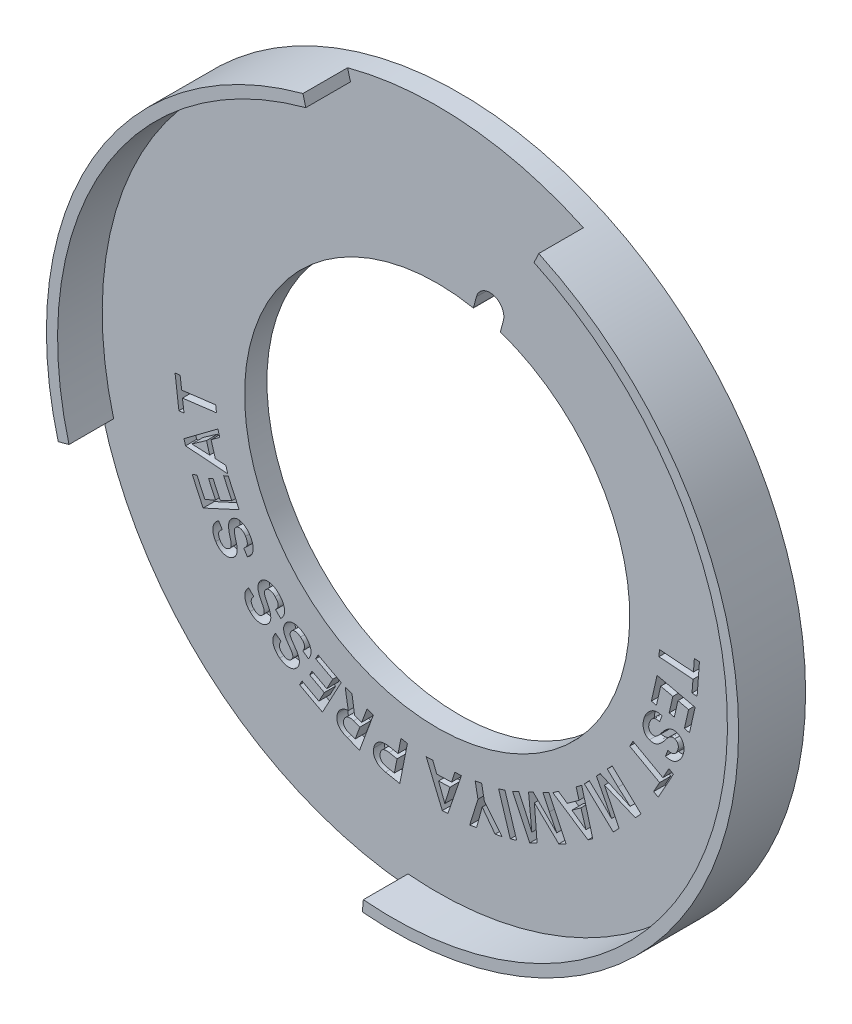
from build123d import *

# Parameters (mm, degrees)
SKETCH_1_R          = 31
SKETCH_1_R_2        = 17.25
EXTRUDE_1_DEPTH     = 2
SKETCH_2_R          = 31
SKETCH_2_R_2        = 30
EXTRUDE_2_DEPTH     = 4
CUT_EXTRUDE_1_DEPTH = 4
SKETCH_4_R          = 30
CUT_EXTRUDE_2_DEPTH = 45.022721406
CUT_EXTRUDE_3_DEPTH = 1


with BuildPart() as part:
    # 草图1 → 凸台-拉伸1 (new body)
    with BuildSketch(Plane.XY):
        Circle(SKETCH_1_R)
        Circle(SKETCH_1_R_2, mode=Mode.SUBTRACT)
    extrude(amount=EXTRUDE_1_DEPTH)

    # 草图2 → 凸台-拉伸2 (add)
    with BuildSketch(Plane.XY.offset(2)):
        Circle(SKETCH_2_R)
        Circle(SKETCH_2_R_2, mode=Mode.SUBTRACT)
    extrude(amount=EXTRUDE_2_DEPTH)

    # 草图3 → 切除-拉伸1 (cut)
    with BuildSketch(Plane.XY.offset(2)):
        with BuildLine():
            Line((3.257221245, 16.98574431), (3.51604029, 17.951670136))
            ThreePointArc((3.51604029, 17.951670136), (5.046971379, 18.835553613), (5.930854856, 17.304622523))
            Line((5.930854856, 17.304622523), (5.672035811, 16.338696697))
            ThreePointArc((5.672035811, 16.338696697), (4.141104722, 15.454813221), (3.257221245, 16.98574431))
        make_face()
    extrude(amount=-CUT_EXTRUDE_1_DEPTH, mode=Mode.SUBTRACT)

    # 草图4 → 切除-拉伸2 (cut, through all)
    with BuildSketch(Plane.XY.offset(2)):
        with BuildLine():
            Line((-8.023390398, -29.943700615), (-7.764571353, -28.977774789))
            ThreePointArc((-7.764571353, -28.977774789), (-21.213203436, -21.213203436), (-28.977774789, -7.764571353))
            Line((-28.977774789, -7.764571353), (-29.943700615, -8.023390398))
            ThreePointArc((-29.943700615, -8.023390398), (-21.920310217, -21.920310217), (-8.023390398, -29.943700615))
        make_face()
        Circle(SKETCH_4_R)
        with BuildLine():
            Line((0, 0), (13.101166114, 28.095541398))
            ThreePointArc((13.101166114, 28.095541398), (2.701828025, 30.882035641), (-8.023390398, 29.943700615))
            Line((-8.023390398, 29.943700615), (0, 0))
        make_face()
        with BuildLine():
            ThreePointArc((-2.614672282, -29.885840943), (-5.20944533, -29.54423259), (-7.764571353, -28.977774789))
            Line((-7.764571353, -28.977774789), (-8.023390398, -29.943700615))
            ThreePointArc((-8.023390398, -29.943700615), (-5.383093508, -30.529040343), (-2.701828025, -30.882035641))
            Line((-2.701828025, -30.882035641), (-2.614672282, -29.885840943))
        make_face()
    extrude(amount=CUT_EXTRUDE_2_DEPTH, mode=Mode.SUBTRACT)

    # 草图5 → 切除-拉伸3 (cut)
    # profile 1 of 19: a face of its own
    with BuildSketch(Plane.XY.offset(2)):
        Polygon((22.828125, -3.128551136), (22.910511364, -2.027698864), (19.865056818, -1.799715909), (19.909090909, -1.213778409), (22.954545455, -1.441761364), (23.036931818, -0.343039773), (23.491477273, -0.377130682), (23.282670455, -3.162642045), align=None)
    # profile 2 of 19: a face of its own
    with BuildSketch(Plane.XY.offset(2)):
        Polygon((20.78451682, -5.695862929), (21.110511138, -4.253391338), (20.019602047, -4.006942475), (19.641050911, -5.682368611), (19.186505456, -5.579385657), (19.695028183, -3.328675429), (23.104119093, -4.09927202), (22.600567956, -6.327254975), (22.146022502, -6.22427202), (22.519602047, -4.571573157), (21.565056593, -4.356374293), (21.239062274, -5.798845884), align=None)
    # profile 3 of 19: a face of its own
    with BuildSketch(Plane.XY.offset(2)):
        with BuildLine():
            add(Edge.make_bspline(
                [(20.093645724, -7.59594016), (20.12433098, -7.555905091), (20.184044574, -7.477996736), (20.276399819, -7.368917371), (20.367088186, -7.269552334), (20.457559468, -7.181788563), (20.545663399, -7.10261671), (20.633541505, -7.034589094), (20.720221315, -6.976528805), (20.806331779, -6.92921631), (20.891845452, -6.890826889), (20.978171748, -6.863305939), (21.064911166, -6.84413789), (21.152394989, -6.836014099), (21.240524134, -6.836358566), (21.328979327, -6.847617329), (21.418445682, -6.867049498), (21.476656204, -6.887888873), (21.50628777, -6.898496978)],
                knots=[0, 0, 0, 0, 1.419376982, 2.76211153, 4.021054644, 5.203636823, 6.308016337, 7.352829206, 8.328502939, 9.240958454, 10.114974499, 10.961985672, 11.786557408, 12.609943949, 13.429466771, 14.261647791, 15.115106758, 16, 16, 16, 16], degree=3))
            add(Edge.make_bspline(
                [(21.50628777, -6.898496978), (21.538857804, -6.911933779), (21.602845435, -6.938331942), (21.691160042, -6.990561829), (21.772539236, -7.049256433), (21.844270566, -7.118308287), (21.908630052, -7.194502323), (21.964726734, -7.279201309), (22.011125659, -7.372797856), (22.050138395, -7.473286934), (22.07975142, -7.57911067), (22.099140702, -7.688531163), (22.10734229, -7.800572901), (22.106012948, -7.915367011), (22.093803202, -8.032792194), (22.070430879, -8.152539132), (22.038135445, -8.275253607), (22.008603216, -8.356332111), (21.993503679, -8.397786751)],
                knots=[0, 0, 0, 0, 0.957996989, 1.882096773, 2.785698347, 3.683743925, 4.584836864, 5.496447016, 6.441809086, 7.423214216, 8.427109727, 9.428395291, 10.443175184, 11.480862949, 12.549878886, 13.652066181, 14.799524568, 16, 16, 16, 16], degree=3))
            add(Edge.make_bspline(
                [(21.993503679, -8.397786751), (21.98186841, -8.427572608), (21.958938984, -8.486271089), (21.917273057, -8.57015344), (21.874892477, -8.651169549), (21.827326531, -8.727397011), (21.77751024, -8.800007764), (21.722545657, -8.867380161), (21.666552429, -8.93267376), (21.60499401, -8.991653145), (21.542340491, -9.047119385), (21.477595562, -9.097012953), (21.411349512, -9.140917852), (21.344213258, -9.180428002), (21.275635145, -9.214774806), (21.204985336, -9.242086073), (21.133451519, -9.265237066), (21.06059014, -9.282861276), (20.986791118, -9.295246654), (20.912161042, -9.300508114), (20.836943245, -9.301476477), (20.760964708, -9.296438099), (20.684329857, -9.285584784), (20.607193713, -9.26930205), (20.529138795, -9.247150977), (20.47776742, -9.228373966), (20.45160027, -9.218809478)],
                knots=[0, 0, 0, 0, 1.17344719, 2.312492371, 3.436313097, 4.529048758, 5.609267785, 6.666726438, 7.719889663, 8.764806778, 9.793437338, 10.791348881, 11.762867741, 12.709493939, 13.650195658, 14.575062994, 15.487677712, 16.408943781, 17.324905129, 18.231539781, 19.152928852, 20.084956978, 21.024091296, 21.992377528, 22.977372921, 24, 24, 24, 24], degree=3))
            Line((20.45160027, -9.218809478), (20.668219588, -8.654178796))
            add(Edge.make_bspline(
                [(20.668219588, -8.654178796), (20.693396149, -8.663432978), (20.742195821, -8.681370336), (20.816104554, -8.699445617), (20.886741941, -8.712087782), (20.954911612, -8.716667742), (21.019871078, -8.712717741), (21.082282856, -8.7033396), (21.141598231, -8.685161311), (21.198182503, -8.660224309), (21.251553459, -8.627846352), (21.30222439, -8.589490201), (21.349285165, -8.544154194), (21.393436598, -8.492741868), (21.434644311, -8.43490057), (21.473097379, -8.370548611), (21.508548536, -8.299820223), (21.528669333, -8.249508349), (21.538958224, -8.223781069)],
                knots=[0, 0, 0, 0, 1.157689001, 2.243945918, 3.281159887, 4.254511692, 5.186429771, 6.087487265, 6.973862001, 7.857401086, 8.751761341, 9.663890737, 10.59687409, 11.568451813, 12.587153513, 13.660385819, 14.803624157, 16, 16, 16, 16], degree=3))
            add(Edge.make_bspline(
                [(21.538958224, -8.223781069), (21.547036742, -8.201617285), (21.562789718, -8.158398274), (21.5813246, -8.093917892), (21.594301925, -8.031459197), (21.602062357, -7.971391645), (21.605358787, -7.913410899), (21.6022647, -7.857775183), (21.594785666, -7.804131516), (21.581085845, -7.753013257), (21.562733683, -7.704224672), (21.538617737, -7.658888534), (21.508961544, -7.616732913), (21.47330738, -7.578628949), (21.432249274, -7.543533742), (21.386133747, -7.511364561), (21.333616565, -7.483738123), (21.296194374, -7.468268925), (21.27688436, -7.460286751)],
                knots=[0, 0, 0, 0, 1.232396909, 2.40315355, 3.502175571, 4.562431732, 5.565658851, 6.531821537, 7.469530686, 8.390692907, 9.291274938, 10.187769587, 11.066419617, 11.97680373, 12.906646603, 13.884616195, 14.908452743, 16, 16, 16, 16], degree=3))
            add(Edge.make_bspline(
                [(21.27688436, -7.460286751), (21.245239832, -7.450327696), (21.183441595, -7.430878771), (21.085732172, -7.426374332), (20.9901405, -7.447022434), (20.912603995, -7.48099383), (20.851310969, -7.520648725), (20.801611063, -7.558305797), (20.749824595, -7.604544393), (20.694214944, -7.657472551), (20.637277443, -7.719482284), (20.577231071, -7.788964159), (20.514170664, -7.865947522), (20.450538611, -7.950021461), (20.386307804, -8.035344523), (20.320999946, -8.116413778), (20.256049522, -8.191281719), (20.19375134, -8.262460889), (20.131106105, -8.327280581), (20.070346757, -8.388048541), (20.00997152, -8.442597665), (19.932456566, -8.507155361), (19.836674335, -8.577050002), (19.7189957, -8.644049249), (19.601679713, -8.693911829), (19.483522642, -8.725124975), (19.364990645, -8.738112674), (19.245586395, -8.733154753), (19.12448768, -8.71340341), (19.046202441, -8.685938032), (19.00628777, -8.671934478)],
                knots=[0, 0, 0, 0, 0.996668806, 1.946383063, 2.90749515, 3.920068711, 4.478121839, 5.104445557, 5.796978624, 6.568876308, 7.41682762, 8.332163956, 9.335980533, 10.414619091, 11.508924341, 12.5539205, 13.550487188, 14.495366895, 15.403531453, 16.266089585, 17.084231709, 17.854182196, 19.305379831, 20.650277047, 21.926068833, 23.135499542, 24.319502412, 25.504428949, 26.727603036, 28, 28, 28, 28], degree=3))
            add(Edge.make_bspline(
                [(19.00628777, -8.671934478), (18.97440406, -8.658774317), (18.9116661, -8.63287891), (18.825723637, -8.580721189), (18.747055628, -8.521788854), (18.678024455, -8.45264826), (18.616322616, -8.375889765), (18.564538882, -8.289496077), (18.52031027, -8.19534804), (18.484919862, -8.093257933), (18.459809146, -7.9846702), (18.44368251, -7.871316032), (18.440170536, -7.753803745), (18.445676553, -7.632649775), (18.462437794, -7.507507632), (18.48987507, -7.378572743), (18.52629187, -7.24510906), (18.559093696, -7.156789601), (18.575890042, -7.11156516)],
                knots=[0, 0, 0, 0, 0.913019636, 1.796559781, 2.656269478, 3.512652068, 4.378977646, 5.26037598, 6.175506448, 7.132040362, 8.118347368, 9.125591538, 10.161665073, 11.229610249, 12.337194053, 13.503887653, 14.721852607, 16, 16, 16, 16], degree=3))
            add(Edge.make_bspline(
                [(18.575890042, -7.11156516), (18.599065934, -7.055591175), (18.644774118, -6.945197618), (18.733749248, -6.790979284), (18.835162918, -6.648192467), (18.931892266, -6.540094175), (19.015195246, -6.461684876), (19.078912882, -6.407456718), (19.144630857, -6.359172298), (19.211375788, -6.315352766), (19.280195844, -6.27798586), (19.350415794, -6.245681593), (19.422021793, -6.218610375), (19.495405464, -6.197320286), (19.570366346, -6.181353478), (19.646899846, -6.172380654), (19.724844309, -6.169153157), (19.8040922, -6.174180639), (19.884977579, -6.183419138), (19.967029999, -6.201511465), (20.050955243, -6.223339447), (20.106113208, -6.243885318), (20.134128679, -6.254320842)],
                knots=[0, 0, 0, 0, 1.819496648, 3.588465364, 5.338204024, 7.076966783, 7.937852125, 8.77617395, 9.590344277, 10.387827535, 11.174472355, 11.941921864, 12.709899147, 13.47337872, 14.236858293, 15.011009971, 15.787252365, 16.578359225, 17.395757936, 18.231811119, 19.101913129, 20, 20, 20, 20], degree=3))
            Line((20.134128679, -6.254320842), (19.91750936, -6.818951524))
            add(Edge.make_bspline(
                [(19.91750936, -6.818951524), (19.891133158, -6.809528044), (19.840146342, -6.791311879), (19.763907265, -6.771830901), (19.69083488, -6.761082018), (19.620780063, -6.757734054), (19.55376788, -6.763598111), (19.489824744, -6.776768228), (19.429579627, -6.799373374), (19.372514676, -6.829182277), (19.319554008, -6.866808847), (19.268379468, -6.908719689), (19.221048577, -6.957453026), (19.175833501, -7.011446604), (19.135174768, -7.07218149), (19.096415311, -7.13793186), (19.060840285, -7.209542682), (19.040722357, -7.26031815), (19.030435497, -7.286281069)],
                knots=[0, 0, 0, 0, 1.173176289, 2.267821673, 3.290482613, 4.263393361, 5.199187819, 6.101907847, 6.99006825, 7.886334336, 8.79161219, 9.707318549, 10.654244786, 11.633456019, 12.654190861, 13.712363667, 14.830267443, 16, 16, 16, 16], degree=3))
            add(Edge.make_bspline(
                [(19.030435497, -7.286281069), (19.020988315, -7.312484209), (19.002650185, -7.363347694), (18.979514333, -7.438518253), (18.963210692, -7.510495316), (18.952256391, -7.579052454), (18.947177207, -7.644376619), (18.947706765, -7.706434392), (18.954011696, -7.764987033), (18.965942063, -7.82009314), (18.983934574, -7.871085087), (19.005751554, -7.918546891), (19.033218694, -7.961565903), (19.064938478, -8.000659292), (19.10192853, -8.035266716), (19.143369444, -8.065614073), (19.188872253, -8.093147991), (19.239046961, -8.114469311), (19.290648426, -8.131322543), (19.342007863, -8.142776008), (19.392261655, -8.149020465), (19.441551849, -8.147655136), (19.490224347, -8.14288507), (19.53711195, -8.129183733), (19.583388995, -8.111647981), (19.628855733, -8.086535657), (19.676024266, -8.054579261), (19.725155351, -8.013590699), (19.778655907, -7.965441757), (19.834823937, -7.907835846), (19.894766248, -7.842238136), (19.958251459, -7.767674222), (20.025392965, -7.685123776), (20.070362124, -7.626364067), (20.093645724, -7.59594016)],
                knots=[0, 0, 0, 0, 1.306729572, 2.536521199, 3.687019967, 4.766203465, 5.790976322, 6.757325845, 7.673547098, 8.54936064, 9.395880176, 10.205758223, 10.994570818, 11.783852431, 12.561720247, 13.363638612, 14.190325747, 15.050792892, 15.914836689, 16.734028773, 17.516560912, 18.283005907, 19.043472426, 19.803289807, 20.566428189, 21.361549204, 22.233339241, 23.235964071, 24.36038014, 25.609134486, 27.00849458, 28.528819189, 30.202733058, 32, 32, 32, 32], degree=3))
        make_face()
    # profile 4 of 19: a face of its own
    with BuildSketch(Plane.XY.offset(2)):
        Polygon((19.388732889, -12.499581308), (19.924244253, -11.533672217), (17.242426071, -10.047166535), (17.536460162, -9.516626763), (20.218278343, -11.003132445), (20.752369253, -10.038643808), (21.161460162, -10.265206308), (19.797823798, -12.726143808), align=None)
    # profile 5 of 19: a face of its own
    with BuildSketch(Plane.XY.offset(2)):
        Polygon((17.75171534, -15.344732867), (14.983249431, -14.197005594), (16.295039204, -16.89089764), (15.774442613, -17.443454458), (13.183533522, -15.003113549), (13.625294886, -14.534363549), (14.64518125, -15.495301049), (15.619613068, -16.472573776), (14.263789204, -13.856096503), (14.601857386, -13.49743173), (17.283675568, -14.696295367), (16.206971022, -13.743880594), (15.233249431, -12.826977185), (15.675010795, -12.358227185), (18.265919886, -14.798568094), align=None)
    # profile 6 of 19: a face of its own
    with BuildSketch(Plane.XY.offset(2)):
        Polygon((11.652102204, -17.275991467), (12.708920386, -16.513917603), (12.446846522, -15.597724421), (12.94471584, -15.239059649), (13.932641976, -18.878264194), (13.508636295, -19.183661921), (10.363039704, -17.099855103), (10.862329476, -16.739769876), align=None)
        Polygon((12.876534022, -17.014627831), (12.067585158, -17.597724421), (13.328948795, -18.489769876), align=None, mode=Mode.SUBTRACT)
    # profile 7 of 19: a face of its own
    with BuildSketch(Plane.XY.offset(2)):
        Polygon((10.895327389, -20.801605483), (8.710668298, -18.702883892), (8.949304662, -21.722770255), (8.29092398, -22.034560028), (6.763225116, -18.807287301), (7.312941025, -18.546633892), (7.913083071, -19.814389574), (8.477003525, -21.104872528), (8.185810343, -18.133991846), (8.605554662, -17.93512821), (10.709247843, -20.040241846), (10.048026252, -18.74762821), (9.469901252, -17.526037301), (10.019617162, -17.265383892), (11.547316025, -20.492656619), align=None)
    # profile 8 of 19: a face of its own
    with BuildSketch(Plane.XY.offset(2)):
        Polygon((5.503004657, -19.225734115), (6.069766021, -19.048887524), (7.118061475, -22.412523888), (6.551300112, -22.589370479), align=None)
    # profile 9 of 19: a face of its own
    with BuildSketch(Plane.XY.offset(2)):
        Polygon((4.036474321, -21.369650694), (3.532212957, -23.218372285), (2.910053867, -23.338400694), (3.653661821, -20.958429104), (3.403661821, -19.660133649), (3.983207276, -19.548627967), (4.231076594, -20.835559785), (5.807070912, -22.779451831), (5.187042503, -22.89948024), align=None)
    # profile 10 of 19: a face of its own
    with BuildSketch(Plane.XY.offset(2)):
        Polygon((-0.037977926, -20.858108747), (1.290147074, -20.815495111), (1.582760711, -19.895750793), (2.168698211, -19.877284884), (0.959181165, -23.41989852), (0.46060162, -23.43552352), (-0.981159744, -19.978137156), (-0.394512017, -19.959671247), align=None)
        Polygon((1.151652756, -21.275012156), (0.123953892, -21.307682611), (0.687874347, -22.782114429), align=None, mode=Mode.SUBTRACT)
    # profile 11 of 19: a face of its own
    with BuildSketch(Plane.XY.offset(2)):
        with BuildLine():
            Line((-3.503601057, -20.995867019), (-3.24223742, -19.6776852))
            Line((-3.24223742, -19.6776852), (-2.662691966, -19.792742019))
            Line((-2.662691966, -19.792742019), (-3.346640829, -23.247287473))
            Line((-3.346640829, -23.247287473), (-4.632152193, -22.992315882))
            add(Edge.make_bspline(
                [(-4.632152193, -22.992315882), (-4.680387916, -22.981896312), (-4.774389216, -22.961590756), (-4.908985647, -22.920086625), (-5.03377736, -22.871228522), (-5.148615668, -22.814637417), (-5.253072901, -22.749408724), (-5.34804046, -22.677204416), (-5.432442939, -22.596285286), (-5.506263756, -22.508225799), (-5.569127732, -22.414664586), (-5.621805527, -22.317684937), (-5.661691347, -22.216722411), (-5.690101809, -22.112862324), (-5.707404363, -22.005945468), (-5.712723385, -21.895984546), (-5.707619767, -21.782575091), (-5.694317915, -21.706936986), (-5.68754992, -21.668452246)],
                knots=[0, 0, 0, 0, 1.24181589, 2.420038531, 3.541122242, 4.612554457, 5.637843112, 6.636741622, 7.61043227, 8.574942052, 9.523728458, 10.443624521, 11.347787383, 12.249964303, 13.149400925, 14.068427841, 15.017214247, 16, 16, 16, 16], degree=3))
            add(Edge.make_bspline(
                [(-5.68754992, -21.668452246), (-5.678537412, -21.628496721), (-5.660888992, -21.550255249), (-5.62326809, -21.438501031), (-5.576221332, -21.335376982), (-5.520057346, -21.241230222), (-5.454667886, -21.15577075), (-5.380763856, -21.078817213), (-5.297484097, -21.010719773), (-5.205581242, -20.952013455), (-5.106012328, -20.901580544), (-4.997854462, -20.863890406), (-4.883142944, -20.834898349), (-4.760942803, -20.818722042), (-4.631975282, -20.811151243), (-4.495734019, -20.816531392), (-4.352019128, -20.829982526), (-4.254671793, -20.848068896), (-4.204595375, -20.8573727)],
                knots=[0, 0, 0, 0, 1.024850425, 2.00687653, 2.945640086, 3.857318846, 4.745127473, 5.633687426, 6.522267141, 7.431341788, 8.358965036, 9.309348201, 10.292500247, 11.315841672, 12.390150068, 13.522644637, 14.725624261, 16, 16, 16, 16], degree=3))
            Line((-4.204595375, -20.8573727), (-3.503601057, -20.995867019))
        make_face()
        with BuildLine():
            Line((-3.593089693, -21.450412473), (-4.299055602, -21.3104977))
            add(Edge.make_bspline(
                [(-4.299055602, -21.3104977), (-4.326473906, -21.305716032), (-4.379702647, -21.296433101), (-4.45815679, -21.287559072), (-4.532547323, -21.285122485), (-4.602792282, -21.289824881), (-4.669077395, -21.298321253), (-4.731322716, -21.314375733), (-4.789615066, -21.335302126), (-4.843441044, -21.362626292), (-4.892836539, -21.395478201), (-4.937591207, -21.433943181), (-4.97793735, -21.477604485), (-5.012870924, -21.527586508), (-5.044036489, -21.582664388), (-5.070245845, -21.643419847), (-5.091831841, -21.709537139), (-5.102020823, -21.755941081), (-5.107294238, -21.779957928)],
                knots=[0, 0, 0, 0, 1.251620135, 2.429842665, 3.548332785, 4.593784982, 5.593671493, 6.549201901, 7.47893246, 8.374183127, 9.257192218, 10.14071476, 11.022438913, 11.923559311, 12.877129898, 13.864234865, 14.894612361, 16, 16, 16, 16], degree=3))
            add(Edge.make_bspline(
                [(-5.107294238, -21.779957928), (-5.111188546, -21.802871244), (-5.11878315, -21.847556361), (-5.124193132, -21.914113777), (-5.121782303, -21.978119847), (-5.113941809, -22.039675461), (-5.100850082, -22.099246657), (-5.079624498, -22.156067796), (-5.053665293, -22.211174105), (-5.020463862, -22.262949035), (-4.982706797, -22.312238163), (-4.93777291, -22.355848126), (-4.889654904, -22.397486006), (-4.834320818, -22.432079914), (-4.775167125, -22.464715614), (-4.710449121, -22.492248719), (-4.640410044, -22.514847762), (-4.591752442, -22.526715574), (-4.566811284, -22.532798837)],
                knots=[0, 0, 0, 0, 1.067687307, 2.082183591, 3.061728629, 4.004840114, 4.931050747, 5.856686311, 6.785957962, 7.724541882, 8.677637624, 9.631415943, 10.596601656, 11.595287251, 12.62230293, 13.699259296, 14.820674737, 16, 16, 16, 16], degree=3))
            Line((-4.566811284, -22.532798837), (-3.83598742, -22.6776852))
            Line((-3.83598742, -22.6776852), (-3.593089693, -21.450412473))
        make_face(mode=Mode.SUBTRACT)
    # profile 12 of 19: a face of its own
    with BuildSketch(Plane.XY.offset(2)):
        with BuildLine():
            Line((-7.397209648, -19.960295185), (-6.756584648, -20.196800867))
            Line((-6.756584648, -20.196800867), (-6.286414193, -18.924073595))
            Line((-6.286414193, -18.924073595), (-5.721783512, -19.132880413))
            Line((-5.721783512, -19.132880413), (-6.946925557, -22.451062231))
            Line((-6.946925557, -22.451062231), (-8.061982375, -22.039130413))
            add(Edge.make_bspline(
                [(-8.061982375, -22.039130413), (-8.109604018, -22.020594499), (-8.202039866, -21.98461542), (-8.332374146, -21.921576057), (-8.45158757, -21.854578578), (-8.55879409, -21.781137019), (-8.654266313, -21.70211933), (-8.738898278, -21.618274116), (-8.811049873, -21.528402614), (-8.870869104, -21.433349019), (-8.919691943, -21.334557574), (-8.955375186, -21.231710556), (-8.978195875, -21.1255505), (-8.988700946, -21.016662808), (-8.987385535, -20.904679004), (-8.972486105, -20.790082397), (-8.946476808, -20.67192752), (-8.919560951, -20.594054204), (-8.905732375, -20.554045185)],
                knots=[0, 0, 0, 0, 1.264204801, 2.453880944, 3.579526963, 4.645581242, 5.665023674, 6.642718441, 7.588814208, 8.510430227, 9.417026034, 10.310099055, 11.197233357, 12.097922445, 13.011965331, 13.962477055, 14.953180658, 16, 16, 16, 16], degree=3))
            add(Edge.make_bspline(
                [(-8.905732375, -20.554045185), (-8.895954069, -20.528779994), (-8.876618538, -20.478820842), (-8.840885086, -20.407553039), (-8.799895363, -20.340951035), (-8.756449854, -20.277175571), (-8.706634606, -20.218760002), (-8.653082264, -20.164000137), (-8.594122024, -20.114290438), (-8.532052225, -20.067978196), (-8.466106759, -20.027365608), (-8.398741425, -19.990807246), (-8.329614364, -19.960239988), (-8.258919999, -19.935064078), (-8.186347759, -19.91620492), (-8.112391316, -19.901734369), (-8.036608728, -19.893180888), (-7.985534981, -19.89152846), (-7.959709648, -19.890692913)],
                knots=[0, 0, 0, 0, 1.056160667, 2.088442139, 3.1034431, 4.104915747, 5.094399405, 6.093315096, 7.088768479, 8.098886361, 9.11085922, 10.106398237, 11.086054565, 12.055564179, 13.029766659, 14.007593887, 14.992544052, 16, 16, 16, 16], degree=3))
            Line((-7.959709648, -19.890692913), (-8.230306239, -18.288420185))
            Line((-8.230306239, -18.288420185), (-8.20402783, -18.216687231))
            Line((-8.20402783, -18.216687231), (-7.628033512, -18.429045185))
            Line((-7.628033512, -18.429045185), (-7.397209648, -19.960295185))
        make_face()
        with BuildLine():
            Line((-6.924198284, -20.651346322), (-7.488118739, -20.443249731))
            add(Edge.make_bspline(
                [(-7.488118739, -20.443249731), (-7.512599908, -20.434509612), (-7.560294269, -20.417482059), (-7.632515535, -20.400109109), (-7.702008618, -20.387960451), (-7.76944875, -20.380824904), (-7.834864133, -20.382048135), (-7.898207288, -20.387960386), (-7.959368771, -20.401062041), (-8.017949198, -20.42004258), (-8.073384036, -20.444918863), (-8.124815143, -20.474893207), (-8.172048335, -20.509603762), (-8.214349705, -20.550443522), (-8.253788422, -20.595481156), (-8.287324625, -20.647111434), (-8.317957267, -20.702902104), (-8.333726173, -20.74300094), (-8.341811921, -20.763562231)],
                knots=[0, 0, 0, 0, 1.21214202, 2.361502446, 3.46022043, 4.50333404, 5.519666297, 6.507813173, 7.467582665, 8.431728463, 9.376118093, 10.296890155, 11.204918044, 12.103489867, 13.035654714, 13.991538613, 14.970130759, 16, 16, 16, 16], degree=3))
            add(Edge.make_bspline(
                [(-8.341811921, -20.763562231), (-8.34984371, -20.786390774), (-8.365466792, -20.830795844), (-8.380694815, -20.897766017), (-8.390607407, -20.962327357), (-8.392590768, -21.024759322), (-8.388315564, -21.085205112), (-8.378042835, -21.143539869), (-8.359779035, -21.199402777), (-8.335632812, -21.253229148), (-8.304273967, -21.304032705), (-8.266744009, -21.352453728), (-8.222545969, -21.397782604), (-8.171796441, -21.440457109), (-8.114581887, -21.48050642), (-8.050586512, -21.516906983), (-7.980573533, -21.55158253), (-7.930757286, -21.571001801), (-7.905022148, -21.581033822)],
                knots=[0, 0, 0, 0, 1.098235111, 2.136238273, 3.11396439, 4.060693242, 4.966165364, 5.862462227, 6.743145233, 7.628541308, 8.535799122, 9.447696045, 10.405774275, 11.405251087, 12.455213716, 13.572805005, 14.746107876, 16, 16, 16, 16], degree=3))
            Line((-7.905022148, -21.581033822), (-7.343942602, -21.787709958))
            Line((-7.343942602, -21.787709958), (-6.924198284, -20.651346322))
        make_face(mode=Mode.SUBTRACT)
    # profile 13 of 19: a face of its own
    with BuildSketch(Plane.XY.offset(2)):
        Polygon((-11.203433158, -18.449110766), (-9.886671795, -19.155076676), (-9.351160431, -18.155076676), (-10.880989977, -17.335474403), (-10.661529749, -16.926383494), (-8.594768386, -18.033627812), (-10.27587634, -21.169991448), (-12.321330886, -20.074110766), (-12.101870658, -19.665019857), (-10.593347931, -20.473258494), (-10.106132022, -19.564167585), (-11.422893386, -18.858201676), align=None)
    # profile 14 of 19: a face of its own
    with BuildSketch(Plane.XY.offset(2)):
        with BuildLine():
            add(Edge.make_bspline(
                [(-12.807862143, -17.253098395), (-12.777457265, -17.293573953), (-12.718495517, -17.372064964), (-12.638147376, -17.49044889), (-12.566729434, -17.604569476), (-12.505577181, -17.715305221), (-12.454042217, -17.822224793), (-12.411920089, -17.925357358), (-12.378684044, -18.024863493), (-12.35585549, -18.121384915), (-12.341759149, -18.214761239), (-12.338391854, -18.306174969), (-12.343606941, -18.39553979), (-12.359781934, -18.483069828), (-12.384370094, -18.568447793), (-12.419453277, -18.651603701), (-12.462014982, -18.733712425), (-12.498277718, -18.784744864), (-12.516668961, -18.810626804)],
                knots=[0, 0, 0, 0, 1.416120012, 2.746168231, 4.001488113, 5.181343884, 6.283376932, 7.320228079, 8.296273694, 9.215207618, 10.091950071, 10.933772005, 11.769999334, 12.591085763, 13.419009265, 14.250501705, 15.112713181, 16, 16, 16, 16], degree=3))
            add(Edge.make_bspline(
                [(-12.516668961, -18.810626804), (-12.538548202, -18.838617166), (-12.581684205, -18.893801548), (-12.656063193, -18.966346059), (-12.736128456, -19.028334094), (-12.821353924, -19.081369496), (-12.91342087, -19.122030538), (-13.010739262, -19.153591792), (-13.113816345, -19.175014544), (-13.22191619, -19.185332056), (-13.332694428, -19.185035461), (-13.444078189, -19.175502735), (-13.555158482, -19.153774431), (-13.665661497, -19.120686375), (-13.776476003, -19.078235228), (-13.886006882, -19.023395598), (-13.995868822, -18.958883982), (-14.066507353, -18.908710591), (-14.102606461, -18.883069986)],
                knots=[0, 0, 0, 0, 0.959535025, 1.891770679, 2.799364323, 3.692791047, 4.597944676, 5.5127074, 6.454036546, 7.43787011, 8.442607748, 9.444957984, 10.455305092, 11.496141023, 12.559804293, 13.658823118, 14.803565204, 16, 16, 16, 16], degree=3))
            add(Edge.make_bspline(
                [(-14.102606461, -18.883069986), (-14.128396253, -18.863457957), (-14.179312928, -18.824738013), (-14.250919896, -18.7626105), (-14.31827952, -18.699058956), (-14.378804738, -18.631434672), (-14.437132429, -18.563881945), (-14.488931692, -18.492360887), (-14.535623049, -18.418672426), (-14.577562901, -18.343254479), (-14.614656556, -18.267115734), (-14.644784021, -18.190121646), (-14.67086561, -18.11399429), (-14.690764772, -18.037790404), (-14.704996095, -17.961842392), (-14.713635711, -17.886125828), (-14.716477445, -17.810626381), (-14.71364822, -17.735364756), (-14.70512289, -17.660566435), (-14.690791169, -17.586517354), (-14.671070535, -17.512994896), (-14.644320106, -17.440665107), (-14.612948959, -17.368498098), (-14.57630812, -17.296723518), (-14.532592996, -17.226463134), (-14.50033348, -17.180965955), (-14.483998507, -17.15792794)],
                knots=[0, 0, 0, 0, 1.174838247, 2.319478115, 3.436934488, 4.530918995, 5.609461753, 6.67258121, 7.730242407, 8.771923542, 9.801179321, 10.799341345, 11.76872362, 12.718435, 13.653121573, 14.569123285, 15.479958926, 16.390794567, 17.298264615, 18.207642011, 19.124166773, 20.055850964, 21.001828515, 21.977276597, 22.975770966, 24, 24, 24, 24], degree=3))
            Line((-14.483998507, -17.15792794), (-13.979737143, -17.530797259))
            add(Edge.make_bspline(
                [(-13.979737143, -17.530797259), (-13.995164611, -17.552863119), (-14.025064226, -17.595628446), (-14.06403702, -17.660921878), (-14.093774161, -17.726158102), (-14.117084238, -17.789839949), (-14.13149137, -17.853105833), (-14.137704679, -17.915090461), (-14.137609343, -17.976243817), (-14.127776176, -18.036037757), (-14.111584679, -18.095097559), (-14.086760099, -18.152199323), (-14.057061477, -18.209353752), (-14.018709278, -18.26432791), (-13.974881223, -18.319667948), (-13.92257289, -18.37214495), (-13.864762839, -18.424972196), (-13.822110642, -18.457272426), (-13.800049643, -18.473979077)],
                knots=[0, 0, 0, 0, 1.173854242, 2.275019389, 3.30958085, 4.295574151, 5.227111363, 6.129953964, 7.007419978, 7.884825274, 8.763929089, 9.670716696, 10.594270059, 11.567701729, 12.588160059, 13.668518064, 14.7940874, 16, 16, 16, 16], degree=3))
            add(Edge.make_bspline(
                [(-13.800049643, -18.473979077), (-13.781516473, -18.487254511), (-13.74518578, -18.51327843), (-13.689296796, -18.546984157), (-13.634297267, -18.576111064), (-13.579611086, -18.598431405), (-13.526175294, -18.616716838), (-13.473344888, -18.628964224), (-13.421214591, -18.635131074), (-13.370005336, -18.637173494), (-13.319754755, -18.631715204), (-13.270864842, -18.621640349), (-13.223807093, -18.603809417), (-13.178233086, -18.580632646), (-13.134856451, -18.54987181), (-13.091931298, -18.514894963), (-13.052004258, -18.471982684), (-13.02732488, -18.440549153), (-13.014538279, -18.424263168)],
                knots=[0, 0, 0, 0, 1.219791915, 2.391166065, 3.490699021, 4.547335785, 5.549132517, 6.511274706, 7.443322611, 8.356046854, 9.247499605, 10.142278515, 11.020300631, 11.932760941, 12.871247201, 13.860949365, 14.891739301, 16, 16, 16, 16], degree=3))
            add(Edge.make_bspline(
                [(-13.014538279, -18.424263168), (-13.004962983, -18.410503113), (-12.986244229, -18.383603573), (-12.96443638, -18.340439408), (-12.946612119, -18.296695618), (-12.935816327, -18.251397415), (-12.928917661, -18.205049876), (-12.928368019, -18.157546901), (-12.933629507, -18.109043818), (-12.943689144, -18.058751765), (-12.960626392, -18.005905733), (-12.983367356, -17.948807298), (-13.014052694, -17.887652748), (-13.049860658, -17.820932657), (-13.093509959, -17.749985323), (-13.144220353, -17.674587668), (-13.20188193, -17.594552181), (-13.264597832, -17.511072881), (-13.329694225, -17.427246544), (-13.389506876, -17.342748136), (-13.445431162, -17.260758644), (-13.496245962, -17.180874119), (-13.54274331, -17.103362706), (-13.58407962, -17.027721429), (-13.620887275, -16.9543187), (-13.663058583, -16.860987357), (-13.704887393, -16.748022272), (-13.738166486, -16.614882179), (-13.754660689, -16.486782654), (-13.752634052, -16.363357505), (-13.733227443, -16.244190969), (-13.69646316, -16.129352205), (-13.643704883, -16.017739595), (-13.596726707, -15.94924102), (-13.572776916, -15.914319986)],
                knots=[0, 0, 0, 0, 0.577031578, 1.128039411, 1.662862827, 2.20109813, 2.728400805, 3.275103113, 3.832835196, 4.407265306, 5.039508616, 5.742494684, 6.523358814, 7.395895704, 8.351593576, 9.392507741, 10.52684883, 11.750672915, 12.990841492, 14.183984548, 15.317709298, 16.410900814, 17.446332817, 18.432167662, 19.380839662, 20.275524916, 21.961009087, 23.524271043, 24.995690144, 26.399221869, 27.763332889, 29.141232966, 30.542581313, 32, 32, 32, 32], degree=3))
            add(Edge.make_bspline(
                [(-13.572776916, -15.914319986), (-13.551084506, -15.887083356), (-13.50841429, -15.833507338), (-13.435649082, -15.762572764), (-13.355921994, -15.703470934), (-13.270924563, -15.653651495), (-13.179053659, -15.615475764), (-13.081301538, -15.586531205), (-12.976972617, -15.570213348), (-12.867864765, -15.563129723), (-12.755022184, -15.566378062), (-12.640504778, -15.582627451), (-12.52474962, -15.609043256), (-12.408094491, -15.646591157), (-12.290962805, -15.697326593), (-12.172710364, -15.758525952), (-12.052580186, -15.830099565), (-11.975308741, -15.885780547), (-11.935703052, -15.914319986)],
                knots=[0, 0, 0, 0, 0.91238757, 1.794718802, 2.655050467, 3.508908648, 4.37125331, 5.257158159, 6.175585797, 7.133522108, 8.120969522, 9.129630712, 10.16110646, 11.230941956, 12.33779119, 13.503787795, 14.72055967, 16, 16, 16, 16], degree=3))
            add(Edge.make_bspline(
                [(-11.935703052, -15.914319986), (-11.887957662, -15.951671999), (-11.793363486, -16.025674596), (-11.667956203, -16.15321796), (-11.556517877, -16.290172924), (-11.478187597, -16.413286791), (-11.423902688, -16.515068127), (-11.388330587, -16.591236469), (-11.358970277, -16.667910132), (-11.335454013, -16.744564815), (-11.317913919, -16.821534977), (-11.30458334, -16.89827822), (-11.298435631, -16.975281884), (-11.297758304, -17.052168161), (-11.30233184, -17.129211312), (-11.314752237, -17.205891566), (-11.333158715, -17.282474397), (-11.359122493, -17.358871624), (-11.391749074, -17.435269464), (-11.431016459, -17.511386808), (-11.47675774, -17.587363595), (-11.511600986, -17.636370307), (-11.529453052, -17.661479077)],
                knots=[0, 0, 0, 0, 1.803408371, 3.572950757, 5.312414225, 7.052791622, 7.907415481, 8.746370836, 9.554123231, 10.350194723, 11.131650063, 11.903475804, 12.667438939, 13.428795795, 14.191717487, 14.962415698, 15.73863916, 16.534460923, 17.361965682, 18.210052232, 19.082913648, 20, 20, 20, 20], degree=3))
            Line((-11.529453052, -17.661479077), (-12.034424643, -17.287899531))
            add(Edge.make_bspline(
                [(-12.034424643, -17.287899531), (-12.018194772, -17.264944366), (-11.986838981, -17.220595438), (-11.947271717, -17.152166126), (-11.917359248, -17.084433584), (-11.895635019, -17.018074527), (-11.882643922, -16.952988325), (-11.877965898, -16.888970102), (-11.883113783, -16.826066294), (-11.896951331, -16.764645903), (-11.917987634, -16.704628346), (-11.944746647, -16.645694065), (-11.978781136, -16.588429714), (-12.018586892, -16.532495195), (-12.064235699, -16.477485316), (-12.116375262, -16.42421309), (-12.174623727, -16.372366349), (-12.216744517, -16.339962713), (-12.23825987, -16.323410895)],
                knots=[0, 0, 0, 0, 1.195932792, 2.31051857, 3.356913543, 4.341341627, 5.275844166, 6.174471712, 7.063790334, 7.951052461, 8.846285532, 9.765899881, 10.700619595, 11.676141456, 12.684807124, 13.739173181, 14.845166813, 16, 16, 16, 16], degree=3))
            add(Edge.make_bspline(
                [(-12.23825987, -16.323410895), (-12.260571407, -16.307289945), (-12.303918949, -16.275969667), (-12.369785374, -16.234765325), (-12.434266988, -16.200490286), (-12.496514381, -16.171900516), (-12.557237819, -16.149519811), (-12.61620197, -16.133817436), (-12.673528548, -16.12423301), (-12.729026685, -16.121538172), (-12.782152965, -16.124099811), (-12.832911849, -16.132824436), (-12.880804832, -16.146910108), (-12.926591198, -16.166260797), (-12.968958113, -16.19185295), (-13.008588254, -16.223279384), (-13.046394835, -16.259089228), (-13.079704122, -16.300911432), (-13.10940695, -16.344996911), (-13.133476993, -16.390535828), (-13.152716539, -16.436445981), (-13.164446551, -16.483410361), (-13.17111806, -16.531047223), (-13.17167458, -16.579213374), (-13.16683402, -16.628154062), (-13.15485154, -16.678083432), (-13.136445741, -16.731303444), (-13.110514446, -16.788859391), (-13.078521826, -16.852645149), (-13.038076701, -16.921347939), (-12.991486427, -16.996776468), (-12.936589407, -17.077107574), (-12.875286162, -17.163728107), (-12.830990445, -17.222441916), (-12.807862143, -17.253098395)],
                knots=[0, 0, 0, 0, 1.307220928, 2.539709137, 3.686692732, 4.773677478, 5.791080222, 6.756639968, 7.668035018, 8.54629269, 9.390861588, 10.189489664, 10.986532844, 11.757282857, 12.544107112, 13.329161593, 14.156257111, 15.011537898, 15.86296605, 16.677894338, 17.454690823, 18.221080937, 18.970115312, 19.734853721, 20.503550259, 21.300037981, 22.167721702, 23.174755899, 24.296209377, 25.555692544, 26.959824579, 28.506769955, 30.176065639, 32, 32, 32, 32], degree=3))
        make_face()
    # profile 15 of 19: a face of its own
    with BuildSketch(Plane.XY.offset(2)):
        with BuildLine():
            add(Edge.make_bspline(
                [(-15.218293203, -15.173829159), (-15.194205991, -15.218598637), (-15.147285551, -15.305806889), (-15.085793204, -15.436333158), (-15.033141496, -15.561515875), (-14.988399742, -15.681143065), (-14.953558646, -15.795971417), (-14.927831756, -15.905830536), (-14.910177486, -16.010420466), (-14.902496473, -16.110455604), (-14.902378424, -16.206113703), (-14.913652948, -16.297878428), (-14.932412153, -16.386339446), (-14.961299398, -16.471494866), (-14.998695323, -16.553441695), (-15.046590268, -16.631103457), (-15.101644324, -16.706703723), (-15.145514212, -16.752206702), (-15.167867066, -16.775391659)],
                knots=[0, 0, 0, 0, 1.407306013, 2.741347511, 3.992755034, 5.166500744, 6.275835178, 7.312437771, 8.288702945, 9.209157915, 10.087482365, 10.93219662, 11.763995718, 12.586863323, 13.416826874, 14.252027817, 15.109362501, 16, 16, 16, 16], degree=3))
            add(Edge.make_bspline(
                [(-15.167867066, -16.775391659), (-15.194088348, -16.800165134), (-15.245840636, -16.849059923), (-15.331523009, -16.910538245), (-15.420821436, -16.961778368), (-15.514898018, -17.001041741), (-15.613035155, -17.029552437), (-15.715523803, -17.046639327), (-15.821997394, -17.052182378), (-15.931635269, -17.046124247), (-16.042270059, -17.030113953), (-16.152210323, -17.002816174), (-16.259737409, -16.964263189), (-16.365919383, -16.915659378), (-16.469298792, -16.855802162), (-16.570965746, -16.785270723), (-16.671189378, -16.704842562), (-16.733927417, -16.643824621), (-16.76587843, -16.612749614)],
                knots=[0, 0, 0, 0, 0.9625635, 1.899787503, 2.808792919, 3.707179783, 4.615701229, 5.532568058, 6.476084794, 7.457488388, 8.460830113, 9.45767519, 10.477655773, 11.507544995, 12.572627458, 13.663598158, 14.810125323, 16, 16, 16, 16], degree=3))
            add(Edge.make_bspline(
                [(-16.76587843, -16.612749614), (-16.788833886, -16.589052339), (-16.833981995, -16.542445243), (-16.896952815, -16.469714772), (-16.953667349, -16.394923311), (-17.005584686, -16.318841325), (-17.052958721, -16.241420169), (-17.093637584, -16.161776455), (-17.130530405, -16.08128426), (-17.160742667, -15.999254748), (-17.185217176, -15.917038139), (-17.205862683, -15.835950137), (-17.218888086, -15.755334414), (-17.227709088, -15.676173108), (-17.230672885, -15.598062287), (-17.227516005, -15.521208772), (-17.220241292, -15.445124177), (-17.205718142, -15.370374583), (-17.185677412, -15.296822858), (-17.160340197, -15.224520974), (-17.128558175, -15.153740893), (-17.09192915, -15.084218102), (-17.048869979, -15.016540965), (-17.00048846, -14.950142607), (-16.945713875, -14.885732968), (-16.906016415, -14.844549472), (-16.885906839, -14.823687114)],
                knots=[0, 0, 0, 0, 1.178578113, 2.317992482, 3.434479557, 4.53004267, 5.607798056, 6.674578627, 7.723165074, 8.769531927, 9.794346106, 10.787215024, 11.756384371, 12.70910132, 13.631643086, 14.545732602, 15.455507576, 16.359563738, 17.262352938, 18.17722473, 19.093541973, 20.031883745, 20.982232477, 21.956665186, 22.964906166, 24, 24, 24, 24], degree=3))
            Line((-16.885906839, -14.823687114), (-16.425679566, -15.286045068))
            add(Edge.make_bspline(
                [(-16.425679566, -15.286045068), (-16.444981502, -15.305845429), (-16.48251592, -15.344349082), (-16.531089129, -15.405629417), (-16.573073058, -15.465885807), (-16.605849236, -15.526756665), (-16.631296165, -15.587258805), (-16.647670235, -15.648213247), (-16.65638119, -15.709034711), (-16.657123198, -15.769924946), (-16.649809277, -15.830466227), (-16.635336374, -15.89094026), (-16.613654971, -15.951153157), (-16.586306379, -16.01205522), (-16.54968704, -16.071575845), (-16.508304477, -16.13242291), (-16.457809433, -16.191840292), (-16.421127973, -16.230585336), (-16.402242066, -16.250533705)],
                knots=[0, 0, 0, 0, 1.197521252, 2.328692043, 3.384396727, 4.375939971, 5.319008666, 6.22240406, 7.103086329, 7.975181642, 8.853230715, 9.73909649, 10.663851428, 11.623295603, 12.626185011, 13.687706019, 14.809486625, 16, 16, 16, 16], degree=3))
            add(Edge.make_bspline(
                [(-16.402242066, -16.250533705), (-16.37068767, -16.280488768), (-16.310556167, -16.337572509), (-16.210575273, -16.402685309), (-16.110467569, -16.448133795), (-16.024992722, -16.466507451), (-15.957578512, -16.469691257), (-15.90768715, -16.465325429), (-15.857943516, -16.454649749), (-15.809254406, -16.436619865), (-15.760987851, -16.412747855), (-15.713127097, -16.382883601), (-15.666419699, -16.345477971), (-15.636433092, -16.317498178), (-15.620992066, -16.303090523)],
                knots=[0, 0, 0, 0, 1.751509083, 3.337755948, 4.787063607, 6.16342893, 6.832384104, 7.503176416, 8.177357616, 8.87806013, 9.591142593, 10.346138706, 11.148376007, 12, 12, 12, 12], degree=3))
            add(Edge.make_bspline(
                [(-15.620992066, -16.303090523), (-15.609070603, -16.290820152), (-15.585686121, -16.26675127), (-15.556543634, -16.226371608), (-15.532299867, -16.184459033), (-15.513055055, -16.14087729), (-15.498388136, -16.095746596), (-15.490259972, -16.048659151), (-15.486372308, -15.999867532), (-15.489047552, -15.948716283), (-15.496227781, -15.893540712), (-15.509925656, -15.833450613), (-15.530489998, -15.767793392), (-15.555891995, -15.69606911), (-15.588073149, -15.61863867), (-15.626931443, -15.535605535), (-15.670400632, -15.446141023), (-15.720741653, -15.353794903), (-15.771504592, -15.259764402), (-15.817971868, -15.166243358), (-15.860870106, -15.075914088), (-15.899320879, -14.988547345), (-15.933202829, -14.904150328), (-15.963764329, -14.822982169), (-15.987938534, -14.744185453), (-16.016736744, -14.645383917), (-16.040380995, -14.526450435), (-16.053962658, -14.38887401), (-16.05113168, -14.258906331), (-16.030257108, -14.136245844), (-15.992976987, -14.020776843), (-15.939685607, -13.911955322), (-15.871275285, -13.808785089), (-15.814172669, -13.748098623), (-15.785054566, -13.717153023)],
                knots=[0, 0, 0, 0, 0.584632971, 1.146783683, 1.698331272, 2.238643067, 2.774014833, 3.317353608, 3.869614406, 4.445200285, 5.066076948, 5.771534459, 6.550446384, 7.418920157, 8.374056906, 9.41777661, 10.55518885, 11.776325203, 13.015566488, 14.210911793, 15.348583555, 16.436618604, 17.475929092, 18.459957465, 19.402649805, 20.294931998, 21.980294571, 23.542239989, 25.016926332, 26.413752061, 27.784120002, 29.153410374, 30.54845024, 32, 32, 32, 32], degree=3))
            add(Edge.make_bspline(
                [(-15.785054566, -13.717153023), (-15.759525432, -13.693347755), (-15.709138206, -13.64636295), (-15.625696822, -13.587278779), (-15.537260767, -13.540023108), (-15.444712909, -13.503334671), (-15.346986884, -13.479167298), (-15.244958809, -13.466787537), (-15.138292707, -13.464385618), (-15.027910173, -13.474862726), (-14.915363777, -13.49596539), (-14.802703028, -13.529005296), (-14.690595492, -13.573181641), (-14.579704338, -13.629901652), (-14.469394709, -13.697411002), (-14.360556827, -13.777218645), (-14.251291843, -13.867172454), (-14.182066472, -13.934665832), (-14.146560248, -13.969283705)],
                knots=[0, 0, 0, 0, 0.903457671, 1.783167614, 2.639195917, 3.49557561, 4.355264466, 5.239132708, 6.153061162, 7.113576706, 8.105849386, 9.115014548, 10.150173419, 11.222520455, 12.337388971, 13.496578441, 14.71597585, 16, 16, 16, 16], degree=3))
            add(Edge.make_bspline(
                [(-14.146560248, -13.969283705), (-14.104603233, -14.013889757), (-14.021765549, -14.101957558), (-13.915886724, -14.24780448), (-13.82528433, -14.400717964), (-13.766178238, -14.535370041), (-13.726840015, -14.64457559), (-13.703283864, -14.725897052), (-13.686470842, -14.80670886), (-13.673988613, -14.886557857), (-13.667695232, -14.965846098), (-13.666887527, -15.04440952), (-13.6719246, -15.122027529), (-13.682422817, -15.199027527), (-13.699534517, -15.27504899), (-13.72304585, -15.350217451), (-13.753862137, -15.424282374), (-13.791464928, -15.497543116), (-13.836733489, -15.569323492), (-13.888026587, -15.640614301), (-13.946125387, -15.711128268), (-13.989503081, -15.755574064), (-14.011617066, -15.778232568)],
                knots=[0, 0, 0, 0, 1.799950736, 3.553726323, 5.289305537, 7.019692691, 7.869999588, 8.703250217, 9.507802799, 10.29677053, 11.079318262, 11.845454093, 12.606157507, 13.365552636, 14.12927883, 14.895826077, 15.679612508, 16.486362626, 17.315411376, 18.173610844, 19.068905264, 20, 20, 20, 20], degree=3))
            Line((-14.011617066, -15.778232568), (-14.471844339, -15.316584841))
            add(Edge.make_bspline(
                [(-14.471844339, -15.316584841), (-14.451608966, -15.295592474), (-14.412660096, -15.25518655), (-14.361663409, -15.191348184), (-14.319657336, -15.127697105), (-14.286574334, -15.064224637), (-14.26249698, -15.001121058), (-14.248331556, -14.937980878), (-14.242129879, -14.87489721), (-14.246368821, -14.812148615), (-14.256983028, -14.749745129), (-14.274976308, -14.68827636), (-14.298819662, -14.627363455), (-14.327948968, -14.566503714), (-14.36411679, -14.506361186), (-14.407472712, -14.44743135), (-14.455450991, -14.388040081), (-14.491663202, -14.350640645), (-14.510196612, -14.331499614)],
                knots=[0, 0, 0, 0, 1.237923724, 2.382744747, 3.46486274, 4.472266459, 5.417318453, 6.324763783, 7.213292543, 8.09959948, 8.987331302, 9.897557996, 10.814425536, 11.763374668, 12.760133213, 13.789970543, 14.86890693, 16, 16, 16, 16], degree=3))
            add(Edge.make_bspline(
                [(-14.510196612, -14.331499614), (-14.529872548, -14.312332952), (-14.568075165, -14.275119138), (-14.627180886, -14.224662963), (-14.68512478, -14.180544557), (-14.742454388, -14.143059677), (-14.798943874, -14.112496071), (-14.85484927, -14.088749157), (-14.909778145, -14.071487638), (-14.963842938, -14.060648915), (-15.016744374, -14.056517448), (-15.068026529, -14.057546928), (-15.117396116, -14.0655487), (-15.164990657, -14.079363645), (-15.211111114, -14.098400141), (-15.255407042, -14.123523807), (-15.297834675, -14.154486519), (-15.33742564, -14.191065564), (-15.373796735, -14.230563922), (-15.404957506, -14.272494482), (-15.430317366, -14.315614716), (-15.451061888, -14.360093946), (-15.4639622, -14.406718212), (-15.47313059, -14.454224101), (-15.474618918, -14.503402546), (-15.472130711, -14.554626516), (-15.462003346, -14.609940865), (-15.446189521, -14.670867197), (-15.424157561, -14.738580851), (-15.394103285, -14.812106875), (-15.360525948, -14.893630536), (-15.318945439, -14.981246936), (-15.271450606, -15.075789967), (-15.236468864, -15.140307447), (-15.218293203, -15.173829159)],
                knots=[0, 0, 0, 0, 1.304750659, 2.533291949, 3.689579734, 4.76279208, 5.784366918, 6.736987479, 7.644166892, 8.515494247, 9.350566666, 10.160724282, 10.946626335, 11.719133424, 12.510809529, 13.311621729, 14.132791853, 15.000627483, 15.868463113, 16.680570383, 17.477264455, 18.242449037, 19.004153606, 19.769751422, 20.535349237, 21.335212983, 22.202465292, 23.200929829, 24.324927254, 25.582324256, 26.973606527, 28.51337112, 30.188432497, 32, 32, 32, 32], degree=3))
        make_face()
    # profile 16 of 19: a face of its own
    with BuildSketch(Plane.XY.offset(2)):
        with BuildLine():
            add(Edge.make_bspline(
                [(-18.047804203, -11.653247816), (-18.033973218, -11.701688677), (-18.007103802, -11.795794598), (-17.973478439, -11.934539274), (-17.947767752, -12.066531663), (-17.929788352, -12.191675554), (-17.919483657, -12.310010824), (-17.917418778, -12.421516053), (-17.921848987, -12.526251109), (-17.934697752, -12.624388748), (-17.95494181, -12.716611228), (-17.98442272, -12.803121061), (-18.021496829, -12.884506021), (-18.066167761, -12.961096806), (-18.120120206, -13.031642398), (-18.18134406, -13.097220015), (-18.250765156, -13.157636815), (-18.302148183, -13.192362402), (-18.328343976, -13.210065997)],
                knots=[0, 0, 0, 0, 1.412101826, 2.743286126, 4.000590455, 5.18034591, 6.285922221, 7.328048878, 8.304725418, 9.221745122, 10.099224946, 10.947092992, 11.778648811, 12.602702679, 13.426970308, 14.262752614, 15.114326723, 16, 16, 16, 16], degree=3))
            add(Edge.make_bspline(
                [(-18.328343976, -13.210065997), (-18.358714543, -13.228586587), (-18.41844656, -13.265012385), (-18.513755684, -13.30575708), (-18.610210865, -13.336423702), (-18.708829411, -13.353966657), (-18.809113276, -13.360383278), (-18.911153562, -13.355518826), (-19.014822964, -13.337765684), (-19.119430254, -13.309752822), (-19.222366209, -13.269747038), (-19.32282044, -13.220713791), (-19.418451045, -13.160566797), (-19.510918515, -13.091536003), (-19.597946091, -13.011416276), (-19.681696835, -12.92226186), (-19.760392547, -12.822495812), (-19.808678432, -12.750872211), (-19.833315567, -12.714327361)],
                knots=[0, 0, 0, 0, 0.962163187, 1.892356754, 2.798740003, 3.697838925, 4.597212074, 5.515062853, 6.457284907, 7.440134871, 8.442609823, 9.443217643, 10.462544486, 11.497258188, 12.563717912, 13.661342629, 14.806735777, 16, 16, 16, 16], degree=3))
            add(Edge.make_bspline(
                [(-19.833315567, -12.714327361), (-19.866029993, -12.659822921), (-19.92991982, -12.553378159), (-20.003352923, -12.385485079), (-20.056210563, -12.216471897), (-20.080864577, -12.073745597), (-20.090640804, -11.9611604), (-20.091915398, -11.878828898), (-20.088527281, -11.798883515), (-20.079918062, -11.720829991), (-20.066547603, -11.645111521), (-20.048169472, -11.57140498), (-20.023788568, -11.500298421), (-19.994563987, -11.431264249), (-19.960732255, -11.364201525), (-19.920524758, -11.300594626), (-19.876627126, -11.2388067), (-19.826313006, -11.180759876), (-19.772054631, -11.12443151), (-19.711633346, -11.071982533), (-19.647271399, -11.021180159), (-19.601062931, -10.990524286), (-19.577633749, -10.97498077)],
                knots=[0, 0, 0, 0, 1.930523699, 3.770227402, 5.554682999, 7.300817082, 8.160127822, 8.98776265, 9.801676471, 10.590750577, 11.372738775, 12.137148197, 12.89717604, 13.654952348, 14.414434977, 15.177183043, 15.940066866, 16.715872716, 17.509689979, 18.315226885, 19.145765759, 20, 20, 20, 20], degree=3))
            Line((-19.577633749, -10.97498077), (-19.243116703, -11.496997816))
            add(Edge.make_bspline(
                [(-19.243116703, -11.496997816), (-19.266156457, -11.512194561), (-19.310694778, -11.541571505), (-19.370416312, -11.59131324), (-19.423290165, -11.641481547), (-19.468874815, -11.693626536), (-19.505743003, -11.748437185), (-19.535230056, -11.804841758), (-19.556970951, -11.863016025), (-19.570265643, -11.923034985), (-19.576750506, -11.984521488), (-19.575863641, -12.047654649), (-19.568065874, -12.112193987), (-19.55263691, -12.177903981), (-19.531358244, -12.245012226), (-19.502571341, -12.313302718), (-19.467056992, -12.383158592), (-19.43877666, -12.428778961), (-19.424224658, -12.452253497)],
                knots=[0, 0, 0, 0, 1.188450312, 2.297402243, 3.343578936, 4.327259011, 5.275109796, 6.183090299, 7.06425608, 7.942819755, 8.824929854, 9.722709623, 10.657793227, 11.620460185, 12.62704271, 13.687986665, 14.810324391, 16, 16, 16, 16], degree=3))
            add(Edge.make_bspline(
                [(-19.424224658, -12.452253497), (-19.411433631, -12.47135493), (-19.386439852, -12.508679296), (-19.346029777, -12.560560588), (-19.30390175, -12.606989656), (-19.260745553, -12.648109127), (-19.216484502, -12.684338803), (-19.170313595, -12.713977421), (-19.122779668, -12.738541259), (-19.074123181, -12.757843482), (-19.024022922, -12.770743813), (-18.973195038, -12.777216004), (-18.921427171, -12.777117257), (-18.868964705, -12.770712865), (-18.815889071, -12.757624587), (-18.762073972, -12.738176065), (-18.707762377, -12.711914088), (-18.672399933, -12.690475929), (-18.654338294, -12.679526225)],
                knots=[0, 0, 0, 0, 1.206081648, 2.35669405, 3.44725648, 4.492953709, 5.482457852, 6.443877927, 7.366217058, 8.286713687, 9.184633622, 10.073744282, 10.968219939, 11.894316408, 12.840444694, 13.830728404, 14.892027903, 16, 16, 16, 16], degree=3))
            add(Edge.make_bspline(
                [(-18.654338294, -12.679526225), (-18.640140946, -12.669887946), (-18.612333601, -12.651010129), (-18.574983324, -12.617783986), (-18.542488877, -12.581720629), (-18.514195995, -12.542769852), (-18.490977286, -12.501003536), (-18.472004414, -12.456330184), (-18.458951185, -12.408491024), (-18.449241473, -12.357219316), (-18.445567635, -12.300806596), (-18.445254032, -12.238353634), (-18.451758535, -12.169158321), (-18.461718984, -12.093359602), (-18.475750707, -12.010521355), (-18.496366339, -11.921235441), (-18.519982412, -11.824647594), (-18.549604743, -11.723899924), (-18.578153276, -11.621261358), (-18.605026643, -11.520639573), (-18.626274802, -11.423500213), (-18.646376474, -11.330940078), (-18.660669773, -11.241928685), (-18.673450588, -11.157045633), (-18.680712455, -11.075918338), (-18.688064541, -10.975117114), (-18.685656259, -10.855954882), (-18.671344891, -10.720870111), (-18.640291403, -10.596904257), (-18.5965144, -10.482877611), (-18.53630922, -10.379511031), (-18.463055868, -10.285067215), (-18.374318822, -10.200757615), (-18.306759884, -10.153804316), (-18.272236022, -10.129810316)],
                knots=[0, 0, 0, 0, 0.589801457, 1.155202511, 1.714529831, 2.257002434, 2.80754537, 3.3550683, 3.922226172, 4.510056456, 5.147158217, 5.863822511, 6.656464114, 7.535290001, 8.493922244, 9.545086521, 10.686745699, 11.913911974, 13.156759462, 14.351807505, 15.495730098, 16.577031917, 17.609286871, 18.596314274, 19.529032265, 20.410420333, 22.071958102, 23.62155012, 25.073315298, 26.455575006, 27.80915597, 29.172695972, 30.555195569, 32, 32, 32, 32], degree=3))
            add(Edge.make_bspline(
                [(-18.272236022, -10.129810316), (-18.242557647, -10.112022469), (-18.184370677, -10.077147887), (-18.091368146, -10.038092397), (-17.996927086, -10.009731758), (-17.900128025, -9.99526559), (-17.801645369, -9.991143695), (-17.701349077, -10.001148136), (-17.598957093, -10.021846909), (-17.495704066, -10.054627592), (-17.392856352, -10.098871659), (-17.29166507, -10.153425173), (-17.194231934, -10.220024388), (-17.099941123, -10.297539121), (-17.008405286, -10.385544653), (-16.920408908, -10.484974585), (-16.834574309, -10.594526269), (-16.782112826, -10.673697933), (-16.755190567, -10.714327361)],
                knots=[0, 0, 0, 0, 0.912173653, 1.78839383, 2.654395868, 3.508047868, 4.36462178, 5.249355175, 6.161036507, 7.117481309, 8.102817406, 9.112110354, 10.146711887, 11.212355933, 12.330365576, 13.494226789, 14.714083699, 16, 16, 16, 16], degree=3))
            add(Edge.make_bspline(
                [(-16.755190567, -10.714327361), (-16.724054616, -10.766304424), (-16.662622255, -10.868857052), (-16.589728699, -11.031687895), (-16.535674116, -11.198890919), (-16.505941711, -11.341277047), (-16.491723073, -11.45509812), (-16.485737228, -11.538801723), (-16.485906271, -11.62065765), (-16.490803391, -11.700360845), (-16.500637761, -11.778251463), (-16.516188239, -11.854267716), (-16.537722452, -11.928218556), (-16.563956685, -12.000260849), (-16.595721458, -12.070162944), (-16.634680325, -12.136979327), (-16.678472355, -12.20220337), (-16.729992572, -12.263699573), (-16.787189189, -12.322761472), (-16.849767676, -12.380119483), (-16.919619157, -12.433786344), (-16.969257496, -12.467197959), (-16.994537158, -12.484213725)],
                knots=[0, 0, 0, 0, 1.811113381, 3.573392374, 5.322361257, 7.058365737, 7.91473593, 8.752248661, 9.566599308, 10.361253552, 11.139456978, 11.913007041, 12.679491383, 13.441184945, 14.204818126, 14.97247916, 15.752227537, 16.551914075, 17.368232796, 18.210402723, 19.088599368, 20, 20, 20, 20], degree=3))
            Line((-16.994537158, -12.484213725), (-17.329054203, -11.962196679))
            add(Edge.make_bspline(
                [(-17.329054203, -11.962196679), (-17.305369442, -11.946208696), (-17.259644456, -11.915342843), (-17.197125074, -11.864773995), (-17.143880669, -11.811419744), (-17.098527858, -11.756500286), (-17.06162915, -11.69953573), (-17.034907226, -11.639910726), (-17.014666594, -11.578902391), (-17.005529262, -11.515297146), (-17.002697381, -11.450824551), (-17.006330306, -11.385396534), (-17.016543077, -11.319127112), (-17.032515205, -11.251651895), (-17.056909354, -11.183947431), (-17.085602165, -11.114714334), (-17.122215404, -11.045301497), (-17.150063237, -10.999689363), (-17.164281476, -10.976401225)],
                knots=[0, 0, 0, 0, 1.199549307, 2.31580872, 3.370156413, 4.35912231, 5.302211945, 6.209631809, 7.096175991, 7.991758007, 8.897215643, 9.803164235, 10.738045614, 11.709674034, 12.709372592, 13.756195852, 14.854383318, 16, 16, 16, 16], degree=3))
            add(Edge.make_bspline(
                [(-17.164281476, -10.976401225), (-17.179323489, -10.953192111), (-17.208511447, -10.908156473), (-17.256631738, -10.846707523), (-17.304025571, -10.79055891), (-17.352872876, -10.741783293), (-17.402210616, -10.699463919), (-17.451932404, -10.663289479), (-17.503261777, -10.635147649), (-17.554549148, -10.61269246), (-17.606109383, -10.597214895), (-17.657190186, -10.586655027), (-17.708103006, -10.584175672), (-17.758319391, -10.587068943), (-17.808396, -10.595193511), (-17.857477677, -10.611463617), (-17.906355124, -10.632901796), (-17.953621649, -10.660203925), (-17.99812331, -10.691844412), (-18.037794639, -10.726843395), (-18.073337035, -10.763400984), (-18.101593843, -10.804231108), (-18.126458994, -10.846469633), (-18.143775704, -10.892527474), (-18.156757018, -10.940547737), (-18.164876612, -10.991974982), (-18.166262273, -11.048622606), (-18.164161546, -11.112201927), (-18.156789486, -11.183573629), (-18.144464211, -11.262689474), (-18.127302041, -11.349384748), (-18.104909396, -11.443738553), (-18.078873949, -11.546168095), (-18.058434512, -11.616611196), (-18.047804203, -11.653247816)],
                knots=[0, 0, 0, 0, 1.300474843, 2.523479049, 3.668700375, 4.75551231, 5.766641425, 6.724731123, 7.642077247, 8.515151647, 9.353655826, 10.170579437, 10.962600602, 11.743502086, 12.534504574, 13.341113562, 14.168897786, 15.041972186, 15.904252915, 16.733010607, 17.528781746, 18.295253504, 19.063341953, 19.828598952, 20.601276409, 21.401477816, 22.270850318, 23.262656714, 24.393051132, 25.64373588, 27.028561391, 28.549563194, 30.205468776, 32, 32, 32, 32], degree=3))
        make_face()
    # profile 17 of 19: a face of its own
    with BuildSketch(Plane.XY.offset(2)):
        Polygon((-20.068985017, -7.955745944), (-19.44327479, -9.314410717), (-18.397820244, -8.832876626), (-19.124382744, -7.254751626), (-18.715291835, -7.066541398), (-17.735888426, -9.194382308), (-20.963161153, -10.680177762), (-21.933331608, -8.573643671), (-21.524240699, -8.385433444), (-20.806911153, -9.942251626), (-19.852365699, -9.502620944), (-20.478075926, -8.143956171), align=None)
    # profile 18 of 19: a face of its own
    with BuildSketch(Plane.XY.offset(2)):
        Polygon((-20.246356305, -5.021768815), (-19.876327895, -6.295206315), (-18.922492668, -6.354865406), (-18.757719941, -6.923047224), (-22.536839259, -6.640376769), (-22.677464259, -6.156711997), (-19.639822214, -3.886825633), (-19.474339259, -4.455717678), align=None)
        Polygon((-20.374197214, -6.278871087), (-20.660418805, -5.294496087), (-21.976469941, -6.214240406), align=None, mode=Mode.SUBTRACT)
    # profile 19 of 19: a face of its own
    with BuildSketch(Plane.XY.offset(2)):
        Polygon((-23.021556064, -1.403062506), (-22.885192428, -2.49326137), (-19.839737883, -2.112579552), (-19.767294701, -2.694255688), (-22.812749246, -3.074937506), (-22.67638561, -4.163005688), (-23.130931064, -4.220534097), (-23.476101519, -1.460590915), align=None)
    extrude(amount=-CUT_EXTRUDE_3_DEPTH, mode=Mode.SUBTRACT)


solid = part.part
